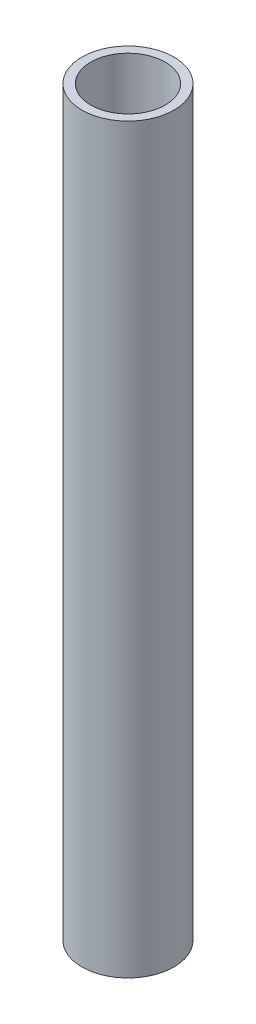
from build123d import *

# Parameters (mm, degrees)
SKETCH1_R           = 5.25
BOSS_EXTRUDE1_DEPTH = 84.6582
SKETCH3_R           = 4.25
CUT_EXTRUDE1_DEPTH  = 30


with BuildPart() as part:
    # Sketch1 → Boss-Extrude1 (new body)
    with BuildSketch(Plane(origin=(0, 0, 0), x_dir=(1, 0, 0), z_dir=(0, 1, 0))):
        with Locations(Location((0, 0, 0), (0, 0, 270))):
            Circle(SKETCH1_R)
    extrude(amount=BOSS_EXTRUDE1_DEPTH)

    # Sketch3 → Cut-Extrude1 (cut)
    with BuildSketch(Plane(origin=(0, 84.6582, 0), x_dir=(1, 0, 0), z_dir=(0, 1, 0))):
        with Locations(Location((0, 0, 0), (0, 0, 270))):
            Circle(SKETCH3_R)
    extrude(amount=-CUT_EXTRUDE1_DEPTH, mode=Mode.SUBTRACT)


solid = part.part
